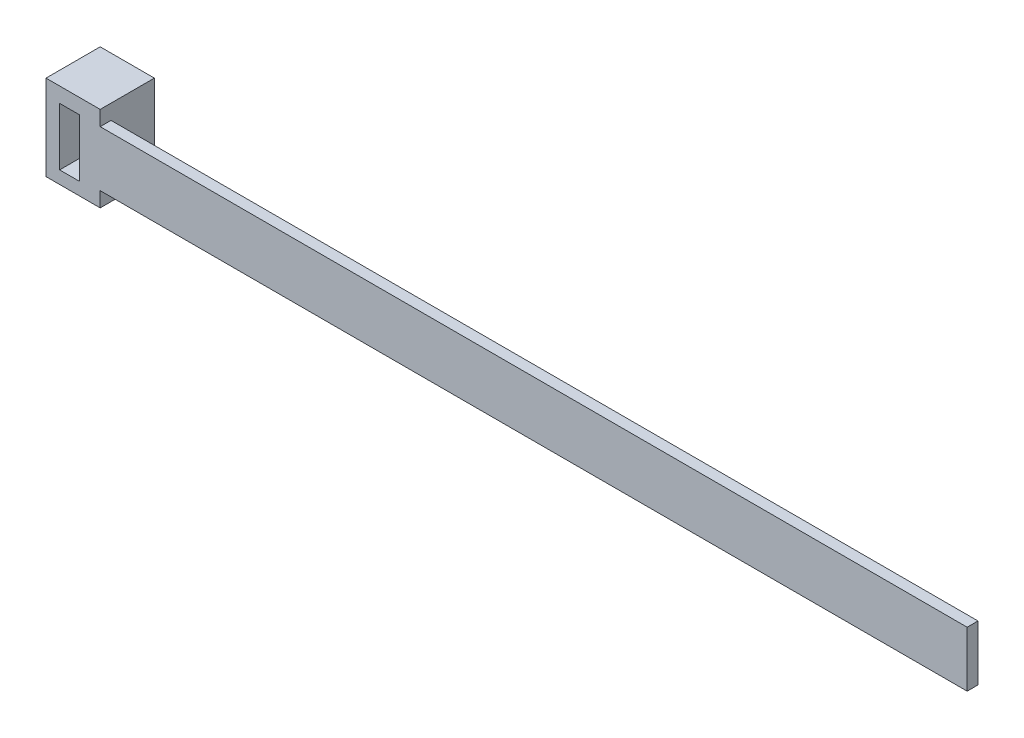
from build123d import *

# Parameters (mm, degrees)
BOSS_EXTRUDE1_DEPTH = 5
CUT_EXTRUDE1_REACH  = 75.47
SKETCH2_W           = 2.306675789
SKETCH2_H           = 6.75004694
CUT_EXTRUDE2_REACH  = 75.371
SKETCH3_W           = 101.6
SKETCH3_H           = 1.753256074


with BuildPart() as part:
    # Sketch1 → Boss-Extrude1 (new, symmetric)
    with BuildSketch(Plane(origin=(0, 0, 0), x_dir=(1, 0, 0), z_dir=(0, 1, 0))):
        Polygon((-73.023921726, 9.380838376), (-66.673921726, 9.380838376), (-66.673921726, 4.300838376), (34.926078274, 4.300838376), (34.926078274, 3.030838376), (-66.673921726, 3.030838376), (-73.023921726, 3.030838376), align=None)
    extrude(amount=BOSS_EXTRUDE1_DEPTH, both=True)

    # Sketch2 → Cut-Extrude1 (cut, up to next)
    with BuildSketch(Plane(origin=(0, 0, -9.380838376), x_dir=(-1, 0, 0), z_dir=(0, 0, -1)), mode=Mode.PRIVATE) as cut_extrude1_sk1:
        with Locations((70.270606821, -0.140509405)):
            Rectangle(SKETCH2_W, SKETCH2_H)
    cut_extrude1_tool1 = extrude(cut_extrude1_sk1.sketch, amount=-CUT_EXTRUDE1_REACH, mode=Mode.PRIVATE) & part.part
    add(cut_extrude1_tool1.solids().sort_by_distance((-70.270607, -0.140509, -9.380838))[0], mode=Mode.SUBTRACT)

    # Sketch3 → Cut-Extrude2 (cut, up to next)
    with BuildSketch(Plane(origin=(0, 0, -4.300838376), x_dir=(-1, 0, 0), z_dir=(0, 0, -1)), mode=Mode.PRIVATE) as cut_extrude2_sk1:
        with Locations((15.873921726, 4.123371963)):
            Rectangle(SKETCH3_W, SKETCH3_H)
    cut_extrude2_tool1 = extrude(cut_extrude2_sk1.sketch, amount=-CUT_EXTRUDE2_REACH, mode=Mode.PRIVATE) & part.part
    # Sketch3 → Cut-Extrude2 (cut, up to next)
    with BuildSketch(Plane(origin=(0, 0, -4.300838376), x_dir=(-1, 0, 0), z_dir=(0, 0, -1)), mode=Mode.PRIVATE) as cut_extrude2_sk2:
        with Locations((15.873921726, -4.123371963)):
            Rectangle(SKETCH3_W, SKETCH3_H)
    cut_extrude2_tool2 = extrude(cut_extrude2_sk2.sketch, amount=-CUT_EXTRUDE2_REACH, mode=Mode.PRIVATE) & part.part
    add(cut_extrude2_tool1.solids().sort_by_distance((-15.873922, 4.123372, -4.300838))[0], mode=Mode.SUBTRACT)
    add(cut_extrude2_tool2.solids().sort_by_distance((-15.873922, -4.123372, -4.300838))[0], mode=Mode.SUBTRACT)


solid = part.part
